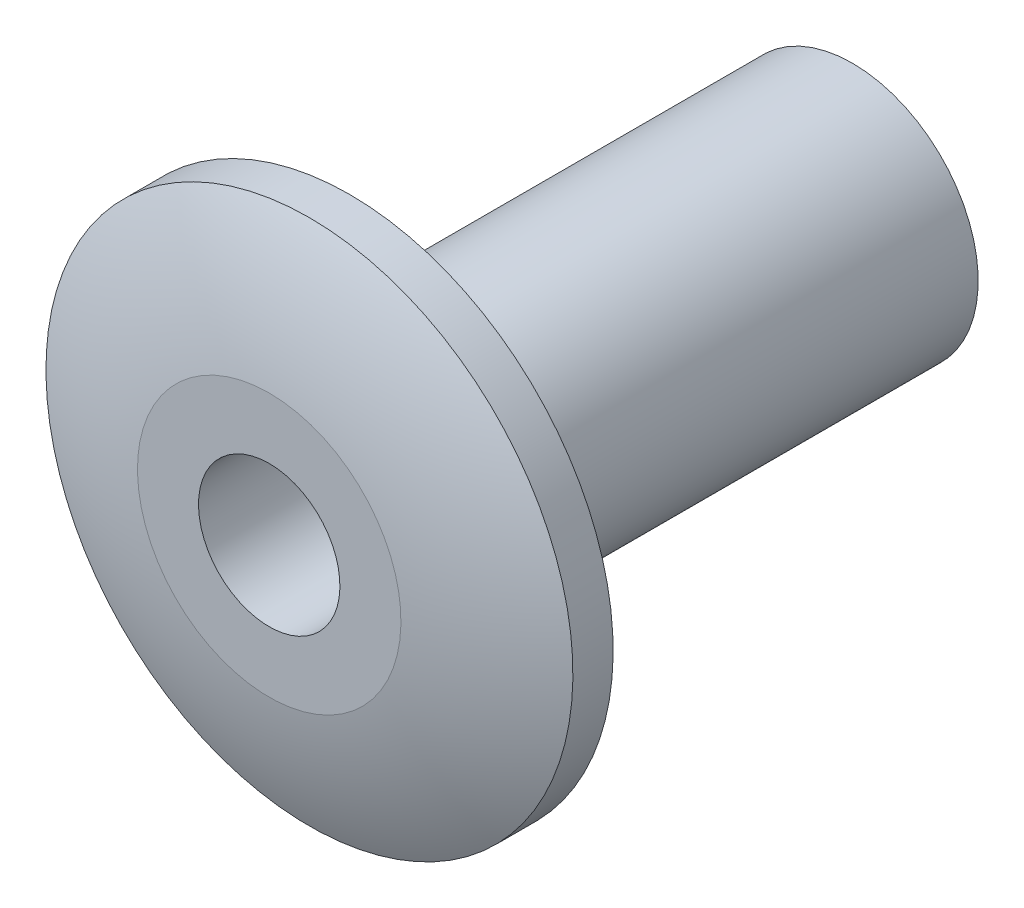
from build123d import *


with BuildPart() as part:
    # Sketch2 → Revolve1 (revolve)
    with BuildSketch(Plane(origin=(0, 0, 0), x_dir=(0, 0, -1), z_dir=(1, 0, 0))):
        with BuildLine():
            Line((6.35, 1.5875), (0, 1.5875))
            Line((0, 1.5875), (0, 3.3274))
            Line((0, 3.3274), (-0.508, 3.3274))
            ThreePointArc((-0.508, 3.3274), (-0.823736431, 2.514400819), (-1.016, 1.6637))
            Line((-1.016, 1.6637), (-1.016, 0.89296875))
            Line((-1.016, 0.89296875), (0, 0.89296875))
            Line((0, 0.89296875), (0.635, 0.89296875))
            Line((0.635, 0.89296875), (0.635, 0))
            Line((0.635, 0), (6.35, 0))
            Line((6.35, 0), (6.35, 1.5875))
        make_face()
    revolve(axis=Axis((0, 0, -6.35), (0, 0, 1)))


solid = part.part
